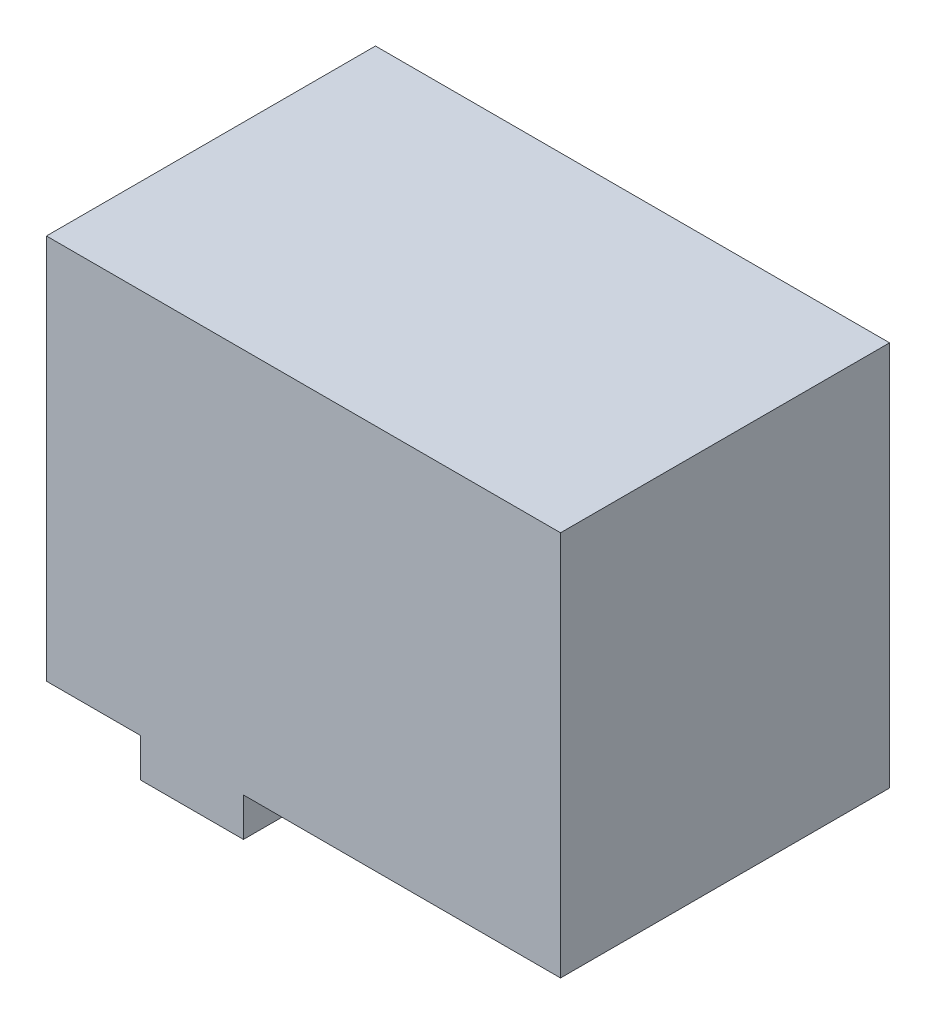
from build123d import *

# Parameters (mm, degrees)
BOSS_EXTRUDE1_DEPTH      = 64
BOSS_EXTRUDE1_DEPTH_BACK = 64
SHELL1_T                 = -5


with BuildPart() as part:
    # Sketch1 → Boss-Extrude1 (new, two sides: drawn at the far end of the back side and taken through both)
    with BuildSketch(Plane.XY.offset(-BOSS_EXTRUDE1_DEPTH_BACK)):
        Polygon((0, 15), (0, 0), (40, 0), (40, 15), (163.345771361, 15), (163.345771361, 165), (-36.654228639, 165), (-36.654228639, 15), align=None)
    extrude(amount=BOSS_EXTRUDE1_DEPTH + BOSS_EXTRUDE1_DEPTH_BACK)

    # Shell1
    shell1_openings = [part.faces().sort_by_distance(p)[0] for p in [
        (20, 0, 0),
    ]]
    offset(amount=SHELL1_T, openings=shell1_openings, kind=Kind.INTERSECTION)


solid = part.part
